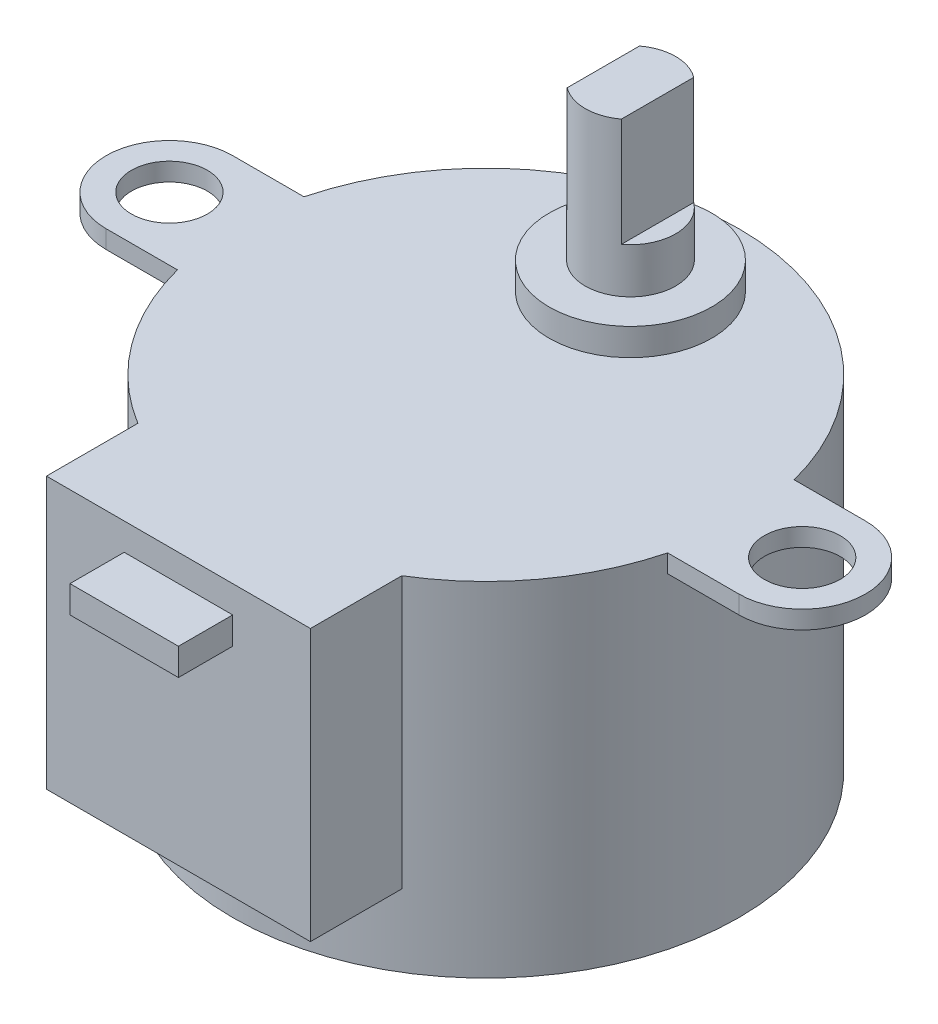
from build123d import *
from build123d.topology import SkipClean

# Parameters (mm, degrees)
SKETCH1_R           = 2.1
BOSS_EXTRUDE1_DEPTH = 1
BOSS_EXTRUDE2_START = -14
BOSS_EXTRUDE2_DEPTH = 14
BOSS_EXTRUDE3_START = 4
SKETCH3_R           = 14
BOSS_EXTRUDE3_DEPTH = 4
SKETCH4_R           = 4.5
BOSS_EXTRUDE4_DEPTH = 1.5
SKETCH5_R           = 2.5
BOSS_EXTRUDE5_DEPTH = 2.5
BOSS_EXTRUDE6_DEPTH = 6
SKETCH7_W           = 6
SKETCH7_H           = 1.5
BOSS_EXTRUDE7_DEPTH = 3


with BuildPart() as part:
    # Sketch1 → Boss-Extrude1 (new body)
    with BuildSketch(Plane(origin=(0, 0, 0), x_dir=(1, 0, 0), z_dir=(0, 1, 0))):
        with BuildLine():
            Line((-17.5, 3.5), (-13.555441712, 3.5))
            ThreePointArc((-13.555441712, 3.5), (0, 14), (13.555441712, 3.5))
            Line((13.555441712, 3.5), (17.5, 3.5))
            ThreePointArc((17.5, 3.5), (21, 0), (17.5, -3.5))
            Line((17.5, -3.5), (13.555441712, -3.5))
            ThreePointArc((13.555441712, -3.5), (11.250406053, -8.332368429), (7.3, -11.94612908))
            Line((7.3, -11.94612908), (7.3, -17))
            Line((7.3, -17), (-7.3, -17))
            Line((-7.3, -17), (-7.3, -11.94612908))
            ThreePointArc((-7.3, -11.94612908), (-11.250406053, -8.332368429), (-13.555441712, -3.5))
            Line((-13.555441712, -3.5), (-17.5, -3.5))
            ThreePointArc((-17.5, -3.5), (-21, 0), (-17.5, 3.5))
        make_face()
        with Locations(Location((-17.5, 0, 0), (0, 0, 270))):
            Circle(SKETCH1_R, mode=Mode.SUBTRACT)
        with Locations(Location((17.5, 0, 0), (0, 0, 270))):
            Circle(SKETCH1_R, mode=Mode.SUBTRACT)
    extrude(amount=BOSS_EXTRUDE1_DEPTH)

    # Sketch2 → Boss-Extrude2 (add)
    with SkipClean():  # the faces are left unmerged after this step: merging them gives an invalid solid
        with BuildSketch(Plane(origin=(0, 0, 0), x_dir=(1, 0, 0), z_dir=(0, 1, 0)).offset(BOSS_EXTRUDE2_START)):
            with BuildLine():
                Line((-7.3, -17), (7.3, -17))
                Line((7.3, -17), (7.3, -11.94612908))
                ThreePointArc((7.3, -11.94612908), (0, 14), (-7.3, -11.94612908))
                Line((-7.3, -11.94612908), (-7.3, -17))
            make_face()
        extrude(amount=BOSS_EXTRUDE2_DEPTH)

    # Sketch3 → Boss-Extrude3 (add)
    with SkipClean():  # the faces are left unmerged after this step: merging them gives an invalid solid
        with BuildSketch(Plane.XZ.offset(14).offset(BOSS_EXTRUDE3_START)):
            with Locations(Location((0, 0, 0), (0, 0, 270))):
                Circle(SKETCH3_R)
        extrude(amount=-BOSS_EXTRUDE3_DEPTH)

    # Sketch4 → Boss-Extrude4 (add)
    with SkipClean():  # the faces are left unmerged after this step: merging them gives an invalid solid
        with BuildSketch(Plane(origin=(0, 1, 0), x_dir=(1, 0, 0), z_dir=(0, 1, 0))):
            with Locations(Location((0, 8, 0), (0, 0, 270))):
                Circle(SKETCH4_R)
        extrude(amount=BOSS_EXTRUDE4_DEPTH)

    # Sketch5 → Boss-Extrude5 (add)
    with SkipClean():  # the faces are left unmerged after this step: merging them gives an invalid solid
        with BuildSketch(Plane(origin=(0, 2.5, 0), x_dir=(1, 0, 0), z_dir=(0, 1, 0))):
            with Locations(Location((0, 8, 0), (0, 0, 270))):
                Circle(SKETCH5_R)
        extrude(amount=BOSS_EXTRUDE5_DEPTH)

    # Sketch6 → Boss-Extrude6 (add)
    with SkipClean():  # the faces are left unmerged after this step: merging them gives an invalid solid
        with BuildSketch(Plane(origin=(0, 5, 0), x_dir=(1, 0, 0), z_dir=(0, 1, 0))):
            with BuildLine():
                ThreePointArc((-1.5, 6), (0, 5.5), (1.5, 6))
                Line((1.5, 6), (1.5, 10))
                ThreePointArc((1.5, 10), (0, 10.5), (-1.5, 10))
                Line((-1.5, 10), (-1.5, 6))
            make_face()
        extrude(amount=BOSS_EXTRUDE6_DEPTH)

    # Sketch7 → Boss-Extrude7 (add)
    with SkipClean():  # the faces are left unmerged after this step: merging them gives an invalid solid
        with BuildSketch(Plane.XY.offset(17)):
            with Locations((0, -1.25)):
                Rectangle(SKETCH7_W, SKETCH7_H)
        extrude(amount=BOSS_EXTRUDE7_DEPTH)


solid = part.part
